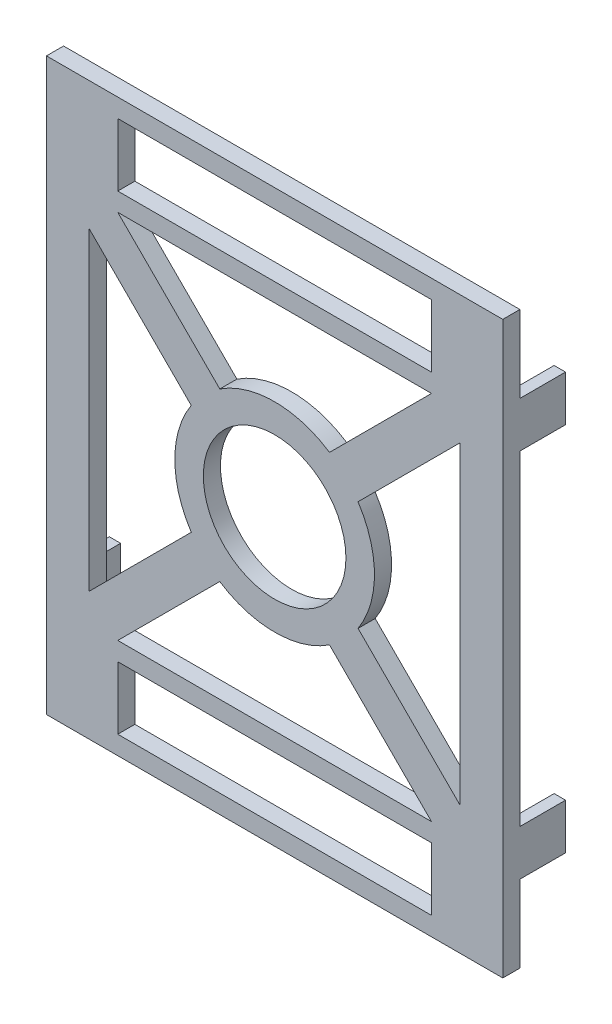
from build123d import *

# Parameters (mm, degrees)
SKETCH1_W           = 80
SKETCH1_H           = 100
SKETCH1_R           = 12.5
SKETCH1_W_2         = 55
SKETCH1_H_2         = 11.012232525
BOSS_EXTRUDE4_DEPTH = 3
SKETCH4_W           = 2
SKETCH4_H           = 8
BOSS_EXTRUDE7_DEPTH = 8


with BuildPart() as part:
    # Sketch1 → Boss-Extrude4 (new body)
    with BuildSketch(Plane.XY):
        Rectangle(SKETCH1_W, SKETCH1_H)
        Circle(SKETCH1_R, mode=Mode.SUBTRACT)
        with BuildLine():
            Line((-27.5, 32.5), (27.5, 32.5))
            Line((27.5, 32.5), (9.624571705, 14.615663498))
            ThreePointArc((9.624571705, 14.615663498), (0.00658569, 17.499998761), (-9.613568497, 14.622903294))
            Line((-9.613568497, 14.622903294), (-27.5, 32.5))
        make_face(mode=Mode.SUBTRACT)
        with BuildLine():
            Line((-32.5, 27.5), (-32.5, -27.529900959))
            Line((-32.5, -27.529900959), (-14.610866481, -9.631852402))
            ThreePointArc((-14.610866481, -9.631852402), (-17.49999836, -0.007575188), (-14.619199644, 9.619199644))
            Line((-14.619199644, 9.619199644), (-32.5, 27.5))
        make_face(mode=Mode.SUBTRACT)
        with BuildLine():
            Line((-27.5, -32.5), (27.5, -32.5))
            Line((27.5, -32.5), (9.619199644, -14.619199644))
            ThreePointArc((9.619199644, -14.619199644), (0, -17.5), (-9.619199644, -14.619199644))
            Line((-9.619199644, -14.619199644), (-27.5, -32.5))
        make_face(mode=Mode.SUBTRACT)
        with BuildLine():
            Line((32.5, 27.5), (14.619199644, 9.619199644))
            ThreePointArc((14.619199644, 9.619199644), (17.4999982, 0.007937724), (14.627919862, -9.60593361))
            Line((14.627919862, -9.60593361), (32.5, -27.5))
            Line((32.5, -27.5), (32.5, 27.5))
        make_face(mode=Mode.SUBTRACT)
        with Locations((0, -41.233086376)):
            Rectangle(SKETCH1_W_2, SKETCH1_H_2, mode=Mode.SUBTRACT)
        with Locations((0, 41.233086376)):
            Rectangle(SKETCH1_W_2, SKETCH1_H_2, mode=Mode.SUBTRACT)
    extrude(amount=BOSS_EXTRUDE4_DEPTH)

    # Sketch4 → Boss-Extrude7 (add)
    with BuildSketch(Plane(origin=(0, 0, 0), x_dir=(-1, 0, 0), z_dir=(0, 0, -1))):
        with Locations((-39, 32.5)):
            Rectangle(SKETCH4_W, SKETCH4_H)
        with Locations((-39, -32.5)):
            Rectangle(SKETCH4_W, SKETCH4_H)
        with Locations((39, 32.5)):
            Rectangle(SKETCH4_W, SKETCH4_H)
        with Locations((39, -32.5)):
            Rectangle(SKETCH4_W, SKETCH4_H)
    extrude(amount=BOSS_EXTRUDE7_DEPTH)


solid = part.part
